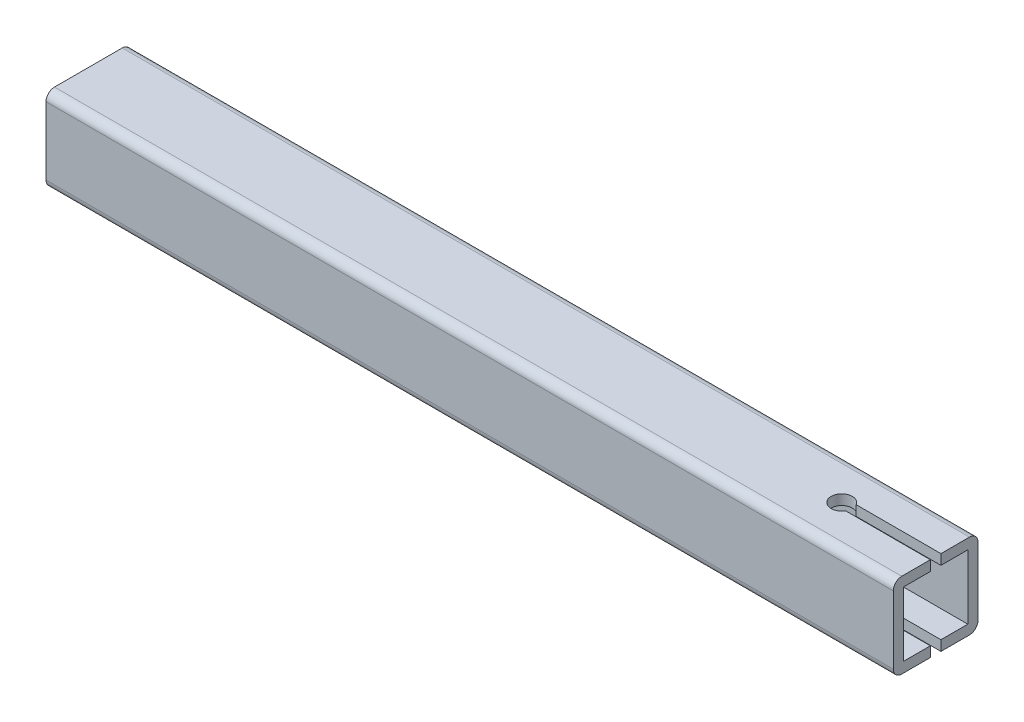
from build123d import *

# Parameters (mm, degrees)
SKETCH1_W               = 19.304
SKETCH1_H               = 19.304
BOSS_EXTRUDE1_DEPTH     = 254
CUT_EXTRUDE1_DEPTH      = 257.527425434
CUT_EXTRUDE1_DEPTH_BACK = 257.527425434


with BuildPart() as part:
    # Sketch1 → Boss-Extrude1 (new body)
    with BuildSketch(Plane(origin=(0, 0, 0), x_dir=(0, 0, -1), z_dir=(1, 0, 0))):
        with BuildLine():
            Line((0, 2.54), (0, 22.86))
            ThreePointArc((0, 22.86), (-0.743948776, 24.656051224), (-2.54, 25.4))
            Line((-2.54, 25.4), (-22.86, 25.4))
            ThreePointArc((-22.86, 25.4), (-24.656051224, 24.656051224), (-25.4, 22.86))
            Line((-25.4, 22.86), (-25.4, 2.54))
            ThreePointArc((-25.4, 2.54), (-24.656051224, 0.743948776), (-22.86, 0))
            Line((-22.86, 0), (-2.54, 0))
            ThreePointArc((-2.54, 0), (-0.743948776, 0.743948776), (0, 2.54))
        make_face()
        with Locations((-12.7, 12.7)):
            Rectangle(SKETCH1_W, SKETCH1_H, mode=Mode.SUBTRACT)
    extrude(amount=BOSS_EXTRUDE1_DEPTH)

    # Sketch2 → Cut-Extrude1 (cut, two sides: drawn at the far end of the back side and taken through both)
    with BuildSketch(Plane(origin=(0, 25.4, 0), x_dir=(1, 0, 0), z_dir=(0, 1, 0)).offset(-CUT_EXTRUDE1_DEPTH_BACK)):
        with BuildLine():
            Line((254, -11.1125), (228.6, -11.1125))
            ThreePointArc((228.6, -11.1125), (222.675369343, -12.7), (228.6, -14.2875))
            Line((228.6, -14.2875), (254, -14.2875))
            Line((254, -14.2875), (254, -11.1125))
        make_face()
    extrude(amount=CUT_EXTRUDE1_DEPTH + CUT_EXTRUDE1_DEPTH_BACK, mode=Mode.SUBTRACT)


solid = part.part
